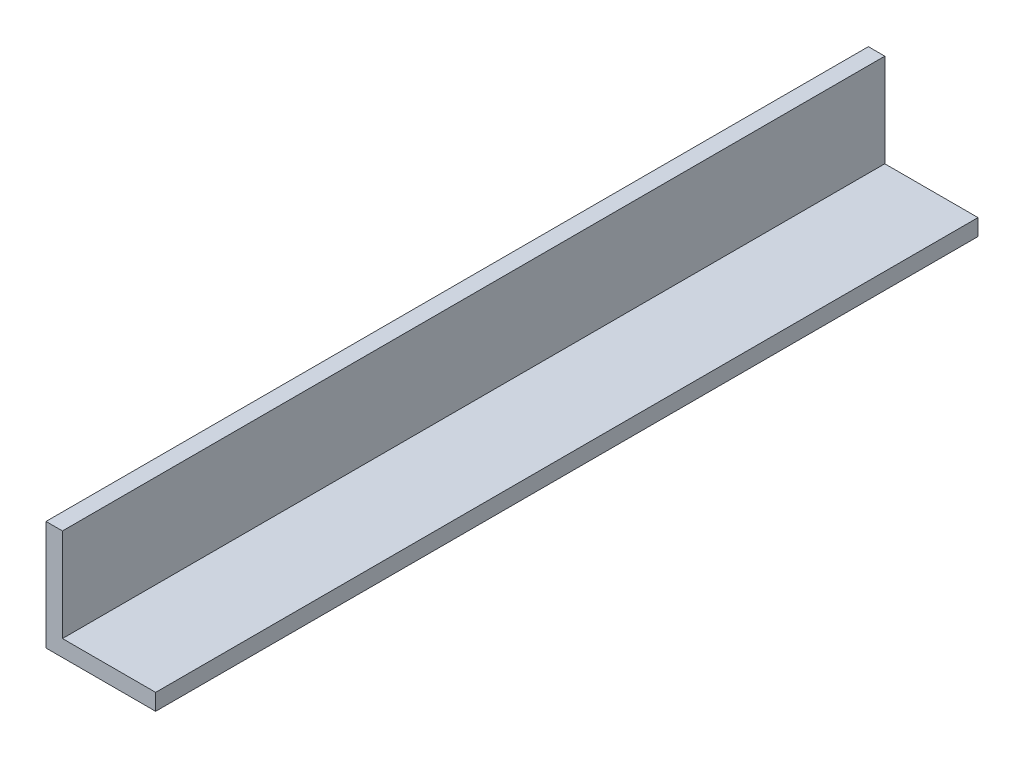
from build123d import *

# Parameters (mm, degrees)
BOSS_EXTRUDE1_DEPTH = 150


with BuildPart() as part:
    # Sketch1 → Boss-Extrude1 (new body)
    with BuildSketch(Plane.XY):
        Polygon((0, 0), (20, 0), (20, 3), (3, 3), (3, 20), (0, 20), align=None)
    extrude(amount=BOSS_EXTRUDE1_DEPTH)


solid = part.part
